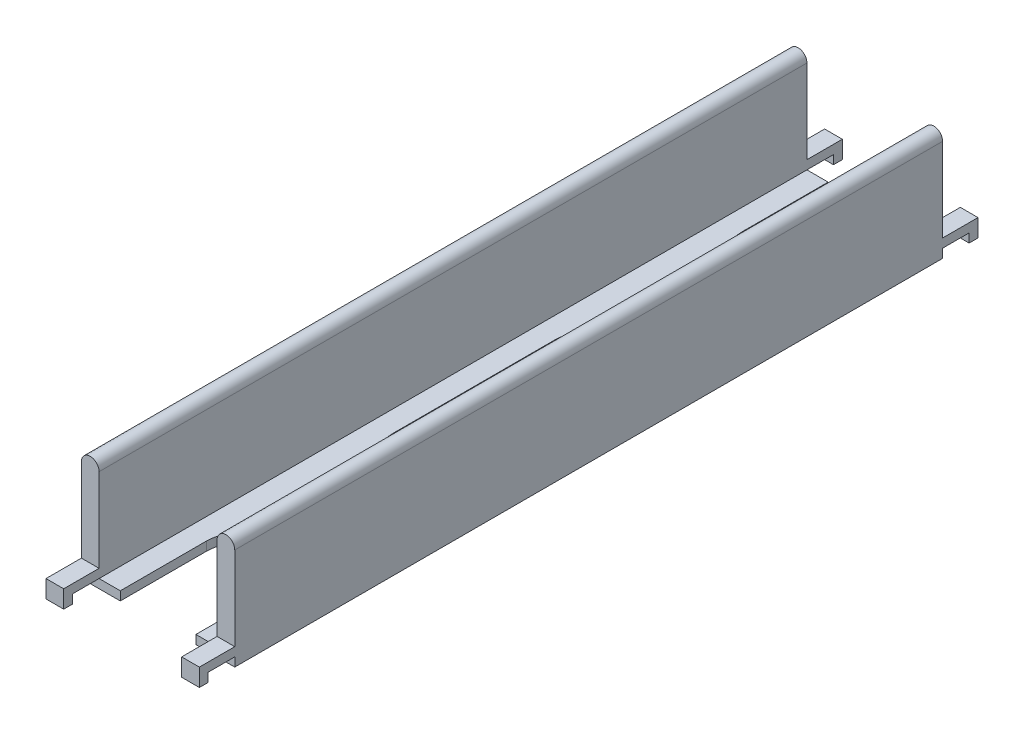
from build123d import *

# Parameters (mm, degrees)
SKETCH1_W           = 6.666666666
SKETCH1_H           = 40
BOSS_EXTRUDE1_DEPTH = 0.5
SKETCH1_3_W         = 1
SKETCH1_3_H         = 40
BOSS_EXTRUDE2_DEPTH = 6.23
SKETCH2_W           = 1
SKETCH2_H           = 0.5
BOSS_EXTRUDE3_DEPTH = 2
SKETCH3_W           = 1
SKETCH3_H           = 0.5
BOSS_EXTRUDE4_DEPTH = 0.5
CUT_EXTRUDE1_DEPTH  = 43.680096975
CUT_EXTRUDE2_DEPTH  = 24.143264199


with BuildPart() as part:
    # Sketch1 → Boss-Extrude1 (new body)
    with BuildSketch(Plane(origin=(0, 0, 0), x_dir=(1, 0, 0), z_dir=(0, 1, 0))):
        Rectangle(SKETCH1_W, SKETCH1_H)
    extrude(amount=BOSS_EXTRUDE1_DEPTH)

    # Sketch1<3> → Boss-Extrude2 (add)
    with BuildSketch(Plane(origin=(0, 0, 0), x_dir=(1, 0, 0), z_dir=(0, 1, 0))):
        with Locations((-3.833333333, 0)):
            Rectangle(SKETCH1_3_W, SKETCH1_3_H)
        with Locations((3.833333333, 0)):
            Rectangle(SKETCH1_3_W, SKETCH1_3_H)
    extrude(amount=BOSS_EXTRUDE2_DEPTH)

    # Sketch2 → Boss-Extrude3 (add)
    with BuildSketch(Plane.XY.offset(20)):
        with Locations((-3.833333333, 0.75)):
            Rectangle(SKETCH2_W, SKETCH2_H)
        with Locations((3.833333333, 0.75)):
            Rectangle(SKETCH2_W, SKETCH2_H)
    boss_extrude3 = extrude(amount=BOSS_EXTRUDE3_DEPTH)

    # Sketch3 → Boss-Extrude4 (add)
    with BuildSketch(Plane.XZ.offset(-0.5)):
        with Locations((-3.833333333, 21.75)):
            Rectangle(SKETCH3_W, SKETCH3_H)
        with Locations((3.833333333, 21.75)):
            Rectangle(SKETCH3_W, SKETCH3_H)
    boss_extrude4 = extrude(amount=BOSS_EXTRUDE4_DEPTH)

    # Mirror1: Boss-Extrude3, Boss-Extrude4 across plane
    add(boss_extrude3.mirror(Plane.XY))
    add(boss_extrude4.mirror(Plane.XY))

    # Sketch5 → Cut-Extrude1 (cut, through all)
    with BuildSketch(Plane.XY.offset(20)):
        with BuildLine():
            Line((-3.333333333, 6.23), (-3.833333333, 6.23))
            ThreePointArc((-3.833333333, 6.23), (-3.479779943, 6.083553391), (-3.333333333, 5.73))
            Line((-3.333333333, 5.73), (-3.333333333, 6.23))
        make_face()
        with BuildLine():
            Line((-4.333333333, 6.23), (-4.333333333, 5.73))
            ThreePointArc((-4.333333333, 5.73), (-4.186886724, 6.083553391), (-3.833333333, 6.23))
            Line((-3.833333333, 6.23), (-4.333333333, 6.23))
        make_face()
        with BuildLine():
            Line((3.833333333, 6.23), (3.333333333, 6.23))
            Line((3.333333333, 6.23), (3.333333333, 5.73))
            ThreePointArc((3.333333333, 5.73), (3.479779943, 6.083553391), (3.833333333, 6.23))
        make_face()
        with BuildLine():
            Line((4.333333333, 6.23), (3.833333333, 6.23))
            ThreePointArc((3.833333333, 6.23), (4.186886724, 6.083553391), (4.333333333, 5.73))
            Line((4.333333333, 5.73), (4.333333333, 6.23))
        make_face()
    extrude(amount=-CUT_EXTRUDE1_DEPTH, mode=Mode.SUBTRACT)

    # Sketch6 → Cut-Extrude2 (cut, through all)
    with BuildSketch(Plane(origin=(0, 0.5, 0), x_dir=(1, 0, 0), z_dir=(0, 1, 0))):
        with BuildLine():
            Line((2.13569746, 4.561085027), (2.13569746, -4.561085027))
            ThreePointArc((2.13569746, -4.561085027), (0, -6.696782487), (-2.13569746, -4.561085027))
            Line((-2.13569746, -4.561085027), (-2.13569746, 4.561085027))
            ThreePointArc((-2.13569746, 4.561085027), (0, 6.696782487), (2.13569746, 4.561085027))
        make_face()
        with BuildLine():
            Line((2.13569746, 24.862478311), (2.13569746, 15.137521689))
            ThreePointArc((2.13569746, 15.137521689), (0, 13.001824229), (-2.13569746, 15.137521689))
            Line((-2.13569746, 15.137521689), (-2.13569746, 24.862478311))
            ThreePointArc((-2.13569746, 24.862478311), (0, 26.998175771), (2.13569746, 24.862478311))
        make_face()
        with BuildLine():
            Line((2.13569746, -24.862478311), (2.13569746, -15.137521689))
            ThreePointArc((2.13569746, -15.137521689), (0, -13.001824229), (-2.13569746, -15.137521689))
            Line((-2.13569746, -15.137521689), (-2.13569746, -24.862478311))
            ThreePointArc((-2.13569746, -24.862478311), (0, -26.998175771), (2.13569746, -24.862478311))
        make_face()
    extrude(amount=-CUT_EXTRUDE2_DEPTH, mode=Mode.SUBTRACT)


solid = part.part
